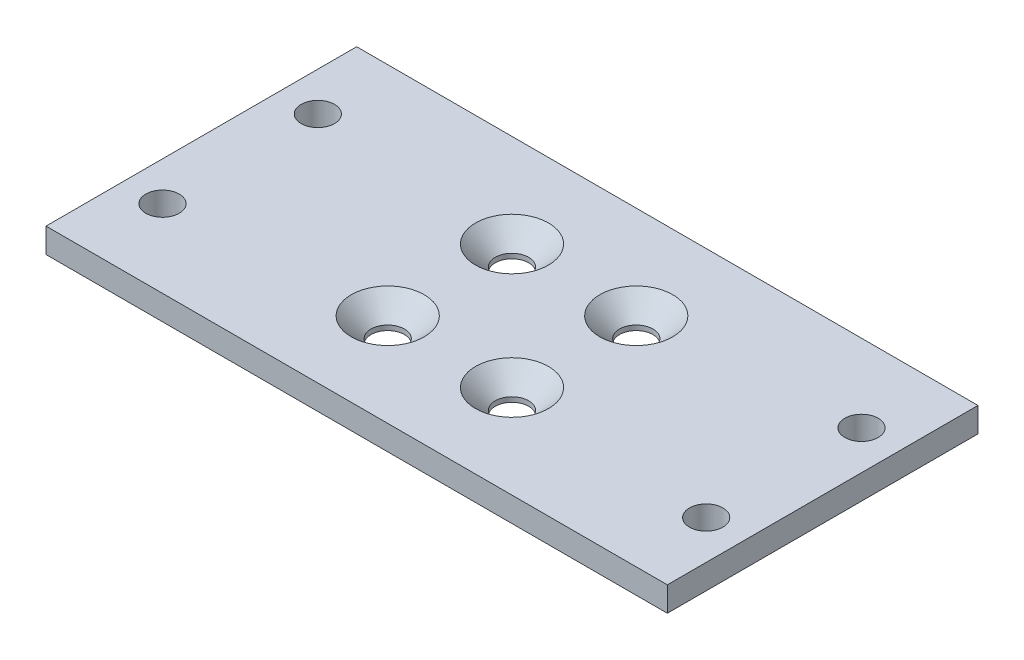
from build123d import *

# Parameters (mm, degrees)
SKETCH2_W                                      = 80
SKETCH2_H                                      = 40
BOSS_EXTRUDE1_DEPTH                            = 3.175
M4_CLEARANCE_HOLE1_D                           = 4.3
CSK_FOR_M4_FLAT_HEAD_MACHINE_SCREW2_AT_2_COUNT = 2
CSK_FOR_M4_FLAT_HEAD_MACHINE_SCREW2_AT_2_PITCH = 16
CSK_FOR_M4_FLAT_HEAD_MACHINE_SCREW2_AT_3_COUNT = 2
CSK_FOR_M4_FLAT_HEAD_MACHINE_SCREW2_AT_3_PITCH = 22.627416998
CSK_FOR_M4_FLAT_HEAD_MACHINE_SCREW2_AT_4_COUNT = 2
CSK_FOR_M4_FLAT_HEAD_MACHINE_SCREW2_AT_4_PITCH = 16


with BuildPart() as part:
    # Sketch2 → Boss-Extrude1 (new body)
    with BuildSketch(Plane(origin=(0, 0, 0), x_dir=(1, 0, 0), z_dir=(0, 1, 0))):
        Rectangle(SKETCH2_W, SKETCH2_H)
    extrude(amount=BOSS_EXTRUDE1_DEPTH)

    # M4 Clearance Hole1 (through all)
    with Locations(Plane(origin=(0, 3.175, 0), x_dir=(1, 0, 0), z_dir=(0, 1, 0))):
        with Locations((-35, 10), (35, 10), (35, -10), (-35, -10)):
            Hole(M4_CLEARANCE_HOLE1_D / 2)

    # Sketch6 → CSK for M4 Flat Head Machine Screw2 (revolve, cut)
    with BuildSketch(Plane(origin=(-8, 3.175, -8), x_dir=(0, 0, 1), z_dir=(1, 0, 0))):
        Polygon((0, 0), (0, 3.175), (2.15, 3.175), (2.15, 2.55), (4.7, 0), align=None)
    csk_for_m4_flat_head_machine_screw2 = revolve(axis=Axis((-8, 9.525, -8), (0, -1, 0)), mode=Mode.SUBTRACT)

    # CSK for M4 Flat Head Machine Screw2 at 2: CSK for M4 Flat Head Machine Screw2 ×2
    with Locations(*[(i * CSK_FOR_M4_FLAT_HEAD_MACHINE_SCREW2_AT_2_PITCH, 0, 0) for i in range(1, CSK_FOR_M4_FLAT_HEAD_MACHINE_SCREW2_AT_2_COUNT)]):
        add(csk_for_m4_flat_head_machine_screw2, mode=Mode.SUBTRACT)

    # CSK for M4 Flat Head Machine Screw2 at 3: CSK for M4 Flat Head Machine Screw2 ×2
    with Locations(*[Vector(0.707106781186545, 0, 0.70710678118655) * (i * CSK_FOR_M4_FLAT_HEAD_MACHINE_SCREW2_AT_3_PITCH) for i in range(1, CSK_FOR_M4_FLAT_HEAD_MACHINE_SCREW2_AT_3_COUNT)]):
        add(csk_for_m4_flat_head_machine_screw2, mode=Mode.SUBTRACT)

    # CSK for M4 Flat Head Machine Screw2 at 4: CSK for M4 Flat Head Machine Screw2 ×2
    with Locations(*[(0, 0, i * CSK_FOR_M4_FLAT_HEAD_MACHINE_SCREW2_AT_4_PITCH) for i in range(1, CSK_FOR_M4_FLAT_HEAD_MACHINE_SCREW2_AT_4_COUNT)]):
        add(csk_for_m4_flat_head_machine_screw2, mode=Mode.SUBTRACT)


solid = part.part
